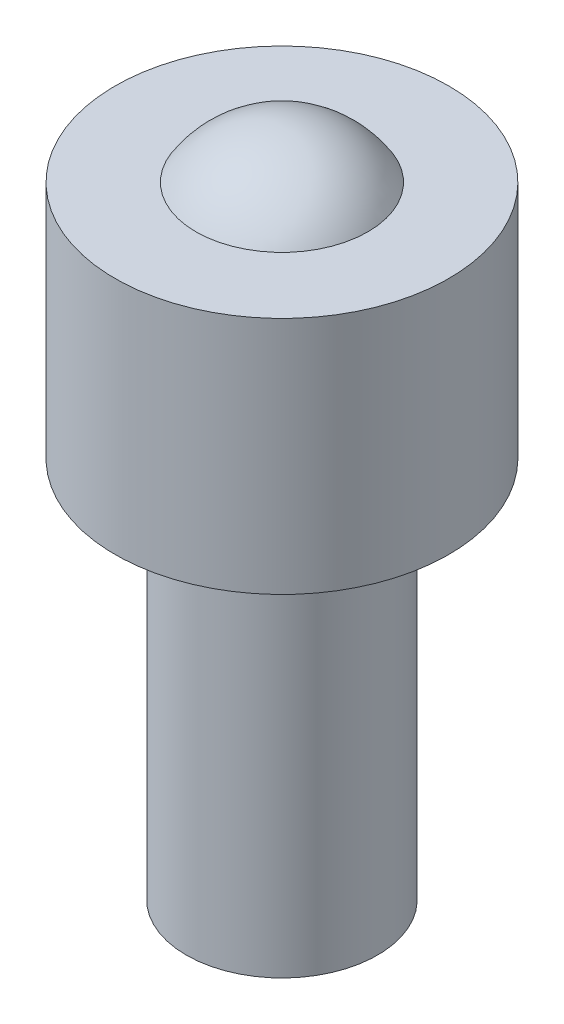
from build123d import *


with BuildPart() as part:
    # 草图1 → 旋转1 (revolve)
    with BuildSketch(Plane.XY, mode=Mode.PRIVATE) as revolve_1_sk:
        with BuildLine():
            Line((2.697220792, 1.675), (5.234128272, 1.675))
            Line((5.234128272, 1.675), (5.234128272, -5.825))
            Line((5.234128272, -5.825), (3, -5.825))
            Line((3, -5.825), (3, -17.825))
            Line((3, -17.825), (0, -17.825))
            Line((0, -17.825), (0, 3.175))
            ThreePointArc((0, 3.175), (1.543129936, 2.774774766), (2.697220792, 1.675))
        make_face()
    revolve(revolve_1_sk.sketch.rotate(Axis((0, -17.825, 0), (0, 1, 0)), 90), axis=Axis((0, -17.825, 0), (0, 1, 0)))


solid = part.part
